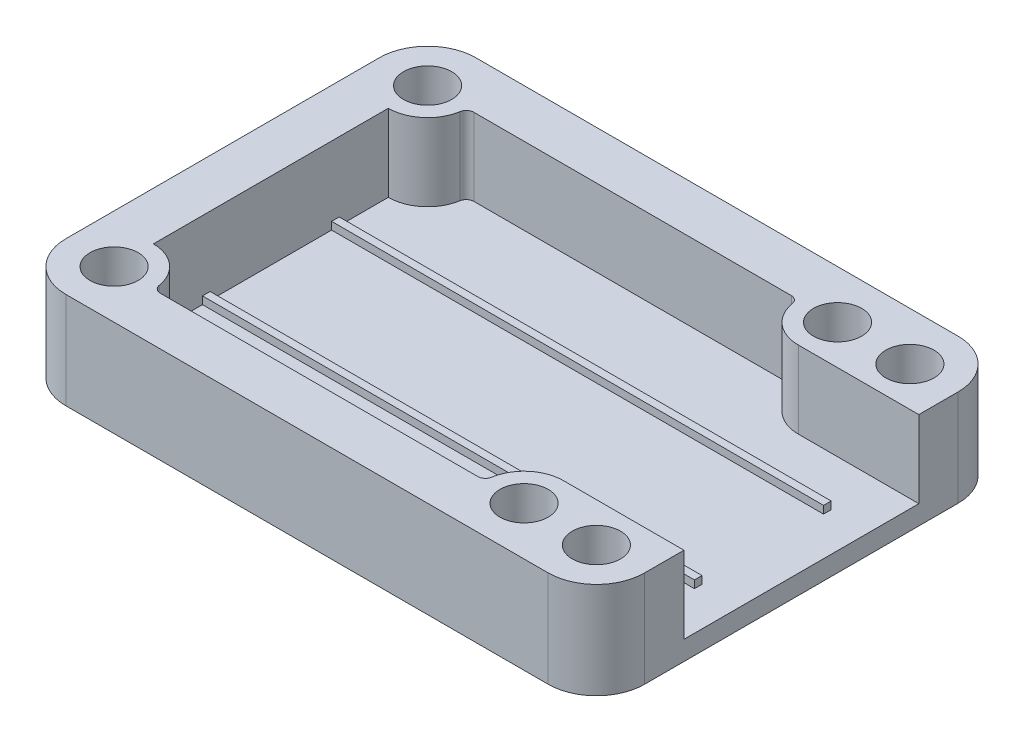
from build123d import *

# Parameters (mm, degrees)
MAIN_BODY_SKETCH_W        = 76.2
MAIN_BODY_SKETCH_H        = 53.975
MAIN_BODY_DEPTH           = 12.7
MOUNTING_HOLES_DEPTH      = 49.386208327
MOUNTING_HOLES_DEPTH_BACK = 49.386208327
MOUNTING_HOLES_SKETCH_R   = 3.175
MAIN_CUTOUT_DEPTH         = 10.16
RIB_SKETCH_W              = 64.77
RIB_SKETCH_H              = 1
RIB_DEPTH                 = 1
OUTER_CORNER_FILLET_R     = 6.35
INNER_CORNER_FILLET_R     = 1


with BuildPart() as part:
    # Main Body Sketch → Main Body (new body)
    with BuildSketch(Plane(origin=(0, 0, 0), x_dir=(1, 0, 0), z_dir=(0, 1, 0))):
        Rectangle(MAIN_BODY_SKETCH_W, MAIN_BODY_SKETCH_H)
    extrude(amount=MAIN_BODY_DEPTH)

    # Mounting Holes Sketch → Mounting Holes (cut, two sides: drawn at the far end of the back side and taken through both)
    with BuildSketch(Plane(origin=(0, 12.7, 0), x_dir=(1, 0, 0), z_dir=(0, 1, 0)).offset(-MOUNTING_HOLES_DEPTH_BACK)):
        with Locations(Location((31.75, -20.6375, 0), (0, 0, 270))):
            Circle(MOUNTING_HOLES_SKETCH_R)
        with Locations(Location((22.225, -20.6375, 0), (0, 0, 270))):
            Circle(MOUNTING_HOLES_SKETCH_R)
        with Locations(Location((-31.75, -20.6375, 0), (0, 0, 270))):
            Circle(MOUNTING_HOLES_SKETCH_R)
        with Locations(Location((31.75, 20.6375, 0), (0, 0, 270))):
            Circle(MOUNTING_HOLES_SKETCH_R)
        with Locations(Location((22.225, 20.6375, 0), (0, 0, 270))):
            Circle(MOUNTING_HOLES_SKETCH_R)
        with Locations(Location((-31.75, 20.6375, 0), (0, 0, 270))):
            Circle(MOUNTING_HOLES_SKETCH_R)
    extrude(amount=MOUNTING_HOLES_DEPTH + MOUNTING_HOLES_DEPTH_BACK, mode=Mode.SUBTRACT)

    # Main Cutout Sketch → Main Cutout (cut)
    with BuildSketch(Plane(origin=(0, 12.7, 0), x_dir=(1, 0, 0), z_dir=(0, 1, 0))):
        with BuildLine():
            Line((31.75, -15.4625), (38.1, -15.4625))
            Line((38.1, -15.4625), (38.1, 15.4625))
            Line((38.1, 15.4625), (22.225, 15.4625))
            ThreePointArc((22.225, 15.4625), (18.565722407, 16.978222407), (17.05, 20.6375))
            Line((17.05, 20.6375), (-26.575, 20.6375))
            ThreePointArc((-26.575, 20.6375), (-28.090722407, 16.978222407), (-31.75, 15.4625))
            Line((-31.75, 15.4625), (-31.75, -15.4625))
            ThreePointArc((-31.75, -15.4625), (-28.090722407, -16.978222407), (-26.575, -20.6375))
            Line((-26.575, -20.6375), (17.05, -20.6375))
            ThreePointArc((17.05, -20.6375), (18.565722407, -16.978222407), (22.225, -15.4625))
            Line((22.225, -15.4625), (31.75, -15.4625))
        make_face()
    extrude(amount=-MAIN_CUTOUT_DEPTH, mode=Mode.SUBTRACT)

    # Rib Sketch → Rib (add)
    with BuildSketch(Plane(origin=(0, 2.54, 0), x_dir=(1, 0, 0), z_dir=(0, 1, 0))):
        with Locations((0.635, -8.5)):
            Rectangle(RIB_SKETCH_W, RIB_SKETCH_H)
        with Locations((0.635, 8.5)):
            Rectangle(RIB_SKETCH_W, RIB_SKETCH_H)
    extrude(amount=RIB_DEPTH)

    # Outer Corner Fillet
    outer_corner_fillet_edges = [part.edges().sort_by_distance(p)[0] for p in [
        (-38.1, 6.35, -26.9875),
        (38.1, 6.35, -26.9875),
        (38.1, 6.35, 26.9875),
        (-38.1, 6.35, 26.9875),
    ]]
    fillet(outer_corner_fillet_edges, radius=OUTER_CORNER_FILLET_R)

    # Inner Corner Fillet
    inner_corner_fillet_edges = [part.edges().sort_by_distance(p)[0] for p in [
        (17.05, 7.62, -20.6375),
        (-26.575, 7.62, -20.6375),
        (-26.575, 7.62, 20.6375),
        (17.05, 7.62, 20.6375),
    ]]
    fillet(inner_corner_fillet_edges, radius=INNER_CORNER_FILLET_R)


solid = part.part
